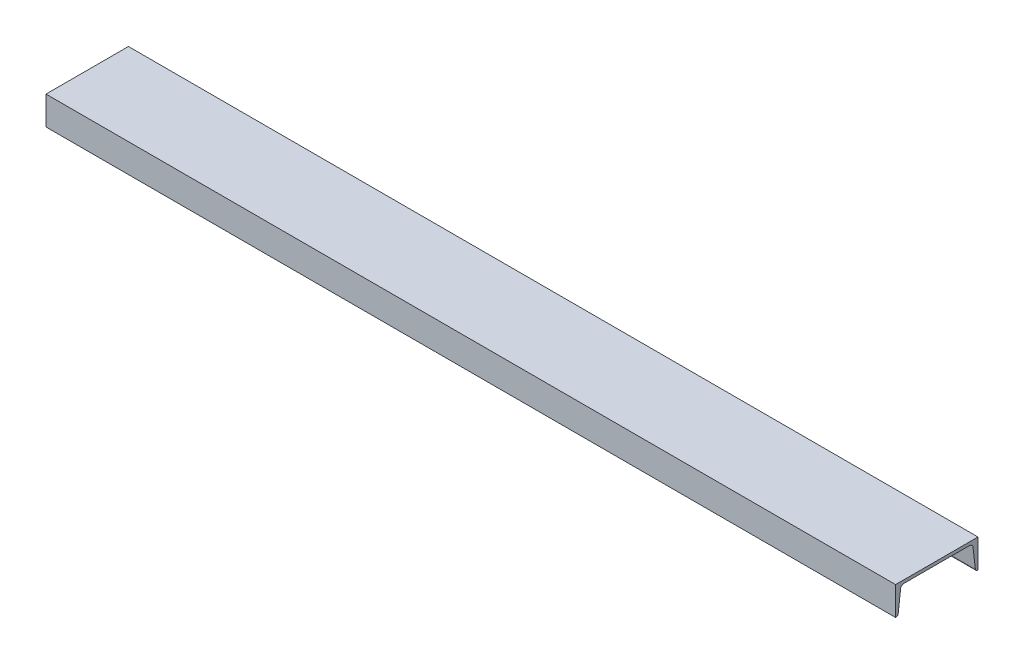
from build123d import *

# Parameters (mm, degrees)
EXTRUDE_1_DEPTH = 2680


with BuildPart() as part:
    # Эскиз2 → Бобышка-Вытянуть1 (new body)
    with BuildSketch(Plane(origin=(0, 0, 0), x_dir=(0, 0, -1), z_dir=(1, 0, 0))):
        with BuildLine():
            Line((130, 0), (-130, 0))
            Line((-130, 0), (-130, -90))
            Line((-130, -90), (-128.678333405, -90))
            ThreePointArc((-128.678333405, -90), (-124.028136062, -88.232175902), (-121.726718983, -83.821618477))
            Line((-121.726718983, -83.821618477), (-113.795983048, -16.720622289))
            ThreePointArc((-113.795983048, -16.720622289), (-108.696165424, -11.795261413), (-101.83727659, -10))
            Line((-101.83727659, -10), (101.83727659, -10))
            ThreePointArc((101.83727659, -10), (108.696165424, -11.795261413), (113.795983048, -16.720622289))
            Line((113.795983048, -16.720622289), (121.726718983, -83.821618477))
            ThreePointArc((121.726718983, -83.821618477), (124.028136062, -88.232175902), (128.678333405, -90))
            Line((128.678333405, -90), (130, -90))
            Line((130, -90), (130, 0))
        make_face()
    extrude(amount=EXTRUDE_1_DEPTH)


solid = part.part
